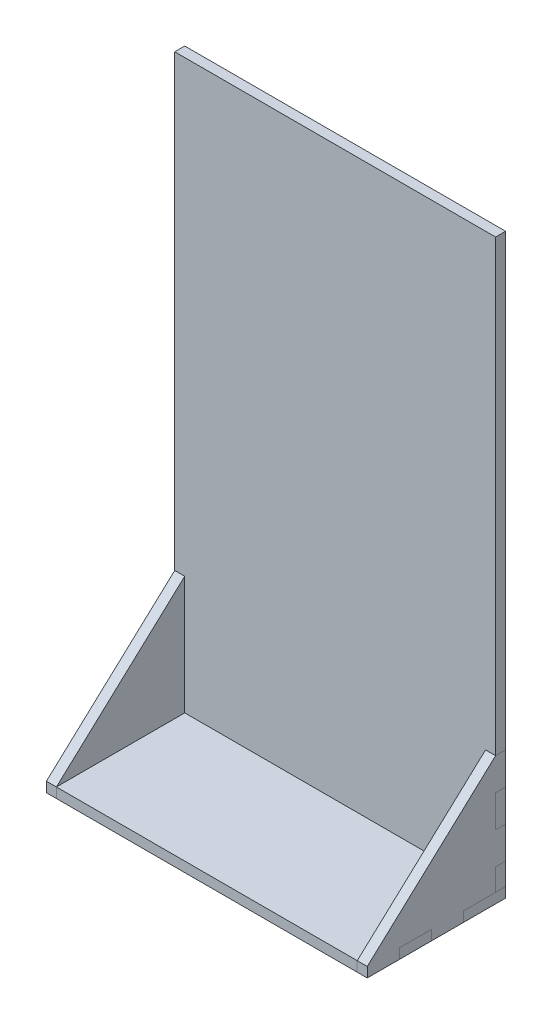
from build123d import *

# Parameters (mm, degrees)
BOSS_EXTRUDE1_DEPTH = 3.12
BOSS_EXTRUDE2_DEPTH = 3.12
BOSS_EXTRUDE3_DEPTH = 3.12


with BuildPart() as part:
    # Sketch1 → Boss-Extrude1 (new body)
    with BuildSketch(Plane.XY):
        Polygon((0, 0), (10, 0), (10, 3.12), (20, 3.12), (20, 0), (30, 0), (30, 3.12), (40, 3.12), (40, 0), (50, 0), (50, 3.12), (60, 3.12), (60, 0), (70, 0), (70, 3.12), (80, 3.12), (80, 0), (90, 0), (90, 3.12), (100, 3.12), (100, 10), (96.88, 10), (96.88, 20), (100, 20), (100, 30), (96.88, 30), (96.88, 40), (100, 40), (100, 180), (0, 180), (0, 40), (3.12, 40), (3.12, 30), (0, 30), (0, 20), (3.12, 20), (3.12, 10), (0, 10), align=None)
    extrude(amount=BOSS_EXTRUDE1_DEPTH)


with BuildPart() as body_2:
    # Sketch2 → Boss-Extrude2 (new body)
    with BuildSketch(Plane.XZ):
        Polygon((10, 3.12), (10, 0), (20, 0), (20, 3.12), (30, 3.12), (30, 0), (40, 0), (40, 3.12), (50, 3.12), (50, 0), (60, 0), (60, 3.12), (70, 3.12), (70, 0), (80, 0), (80, 3.12), (90, 3.12), (90, 0), (100, 0), (100, 3.12), (100, 13.12), (96.88, 13.12), (96.88, 23.12), (100, 23.12), (100, 33.12), (96.88, 33.12), (96.88, 43.12), (3.12, 43.12), (3.12, 33.12), (0, 33.12), (0, 23.12), (3.12, 23.12), (3.12, 13.12), (0, 13.12), (0, 3.12), align=None)
    extrude(amount=-BOSS_EXTRUDE2_DEPTH)


with BuildPart() as body_3:
    # Sketch3 → Boss-Extrude3 (new body)
    with BuildSketch(Plane.ZY):
        Polygon((3.12, 40), (0, 40), (0, 30), (3.12, 30), (3.12, 20), (0, 20), (0, 10), (3.12, 10), (3.12, 3.12), (13.12, 3.12), (13.12, 0), (23.12, 0), (23.12, 3.12), (33.12, 3.12), (33.12, 0), (43.12, 0), (43.12, 3.12), align=None)
    extrude(amount=-BOSS_EXTRUDE3_DEPTH)


with BuildPart() as body_4:
    # Mirror1: mirrored copy
    add(body_3.part.mirror(Plane.ZY.offset(-50)))


solid = Compound([part.part, body_2.part, body_3.part, body_4.part])
